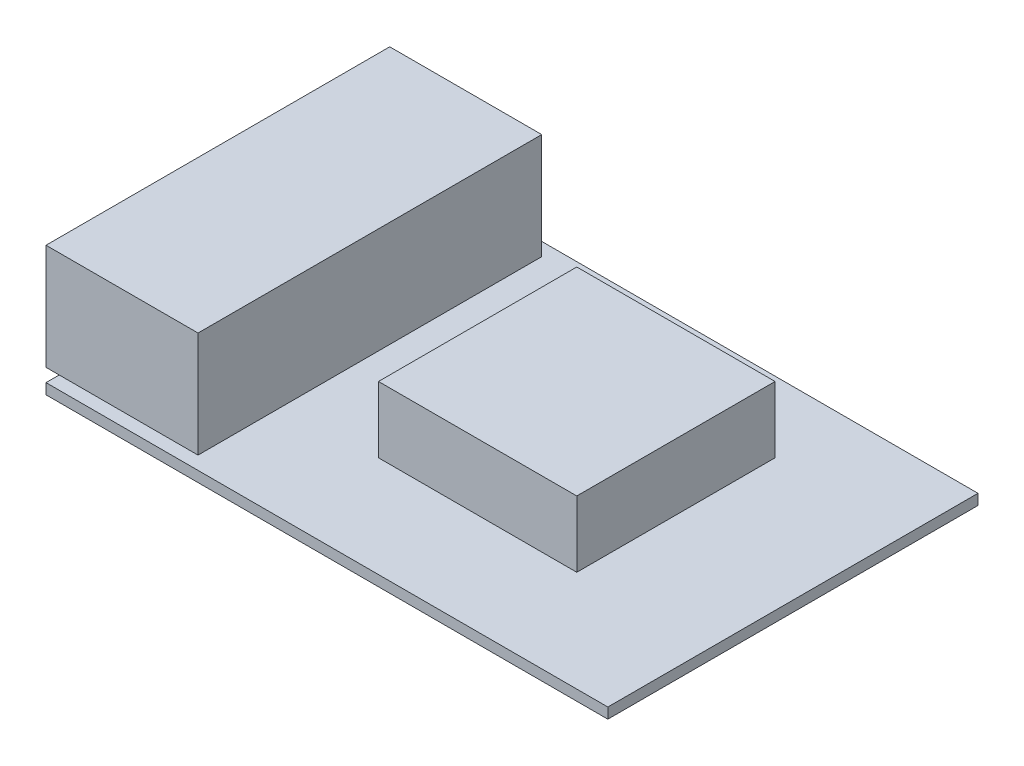
from build123d import *

# Parameters (mm, degrees)
SKETCH1_W              = 85
SKETCH1_H              = 56
PI_4_PCB_DEPTH         = 1.6
SKETCH2_W              = 23
SKETCH2_H              = 52
USB_AND_ETHERNET_DEPTH = 16
SKETCH3_W              = 30
SKETCH3_H              = 30
FAN_DEPTH              = 10


with BuildPart() as part:
    # Sketch1 → Pi 4 PCB (new body)
    with BuildSketch(Plane(origin=(0, -18, 0), x_dir=(1, 0, 0), z_dir=(0, 1, 0))):
        with Locations((2.5, -54.3)):
            Rectangle(SKETCH1_W, SKETCH1_H)
    extrude(amount=PI_4_PCB_DEPTH)

    # Sketch2 → USB And Ethernet (add)
    with BuildSketch(Plane(origin=(0, -16.4, 0), x_dir=(1, 0, 0), z_dir=(0, 1, 0))):
        with Locations((-30.5, -54.3)):
            Rectangle(SKETCH2_W, SKETCH2_H)
    extrude(amount=USB_AND_ETHERNET_DEPTH)


with BuildPart() as body_2:
    # Sketch3 → Fan (new body)
    with BuildSketch(Plane(origin=(0, -10.4, 0), x_dir=(1, 0, 0), z_dir=(0, 1, 0))):
        with Locations((16, -58)):
            Rectangle(SKETCH3_W, SKETCH3_H)
    extrude(amount=FAN_DEPTH)


solid = Compound([part.part, body_2.part])
